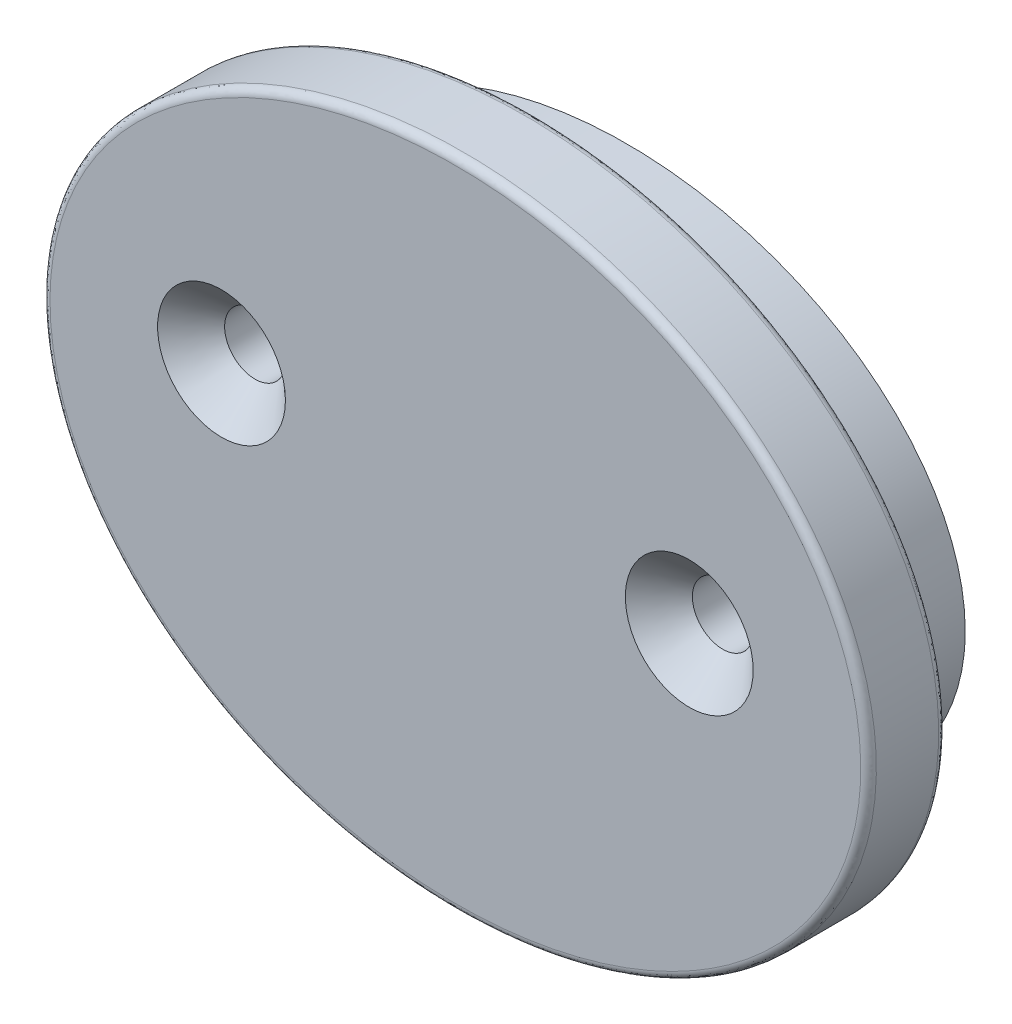
from build123d import *

# Parameters (mm, degrees)
SKIZZE1_RX                                           = 21.7
SKIZZE1_RY                                           = 16.2
AUFSATZ_LINEAR_AUSTRAGEN1_DEPTH                      = 6
SKIZZE2_RX                                           = 26.5
SKIZZE2_RY                                           = 21
AUFSATZ_LINEAR_AUSTRAGEN2_DEPTH                      = 5
FORMSENKUNG_F_R_M3_5_LINSENSENKSCHRAUBE1_D           = 3.9
FORMSENKUNG_F_R_M3_5_LINSENSENKSCHRAUBE1_CSINK_D     = 8.2
FORMSENKUNG_F_R_M3_5_LINSENSENKSCHRAUBE1_CSINK_ANGLE = 90
VERRUNDUNG1_R                                        = 0.5


with BuildPart() as part:
    # Skizze1 → Aufsatz-Linear austragen1 (new body)
    with BuildSketch(Plane.XY):
        with Locations((0, 0)):
            Ellipse(SKIZZE1_RX, SKIZZE1_RY)
    extrude(amount=AUFSATZ_LINEAR_AUSTRAGEN1_DEPTH)

    # Skizze2 → Aufsatz-Linear austragen2 (add)
    with BuildSketch(Plane.XY.offset(6)):
        with Locations((0, 0)):
            Ellipse(SKIZZE2_RX, SKIZZE2_RY)
    extrude(amount=AUFSATZ_LINEAR_AUSTRAGEN2_DEPTH)

    # Formsenkung für M3.5 Linsensenkschraube1 (through all)
    with Locations(Plane(origin=(-15, 2, 11), x_dir=(1, 0, 0), z_dir=(0, 0, 1))):
        with Locations((0, 0), (30, 0)):
            CounterSinkHole(FORMSENKUNG_F_R_M3_5_LINSENSENKSCHRAUBE1_D / 2, FORMSENKUNG_F_R_M3_5_LINSENSENKSCHRAUBE1_CSINK_D / 2, counter_sink_angle=FORMSENKUNG_F_R_M3_5_LINSENSENKSCHRAUBE1_CSINK_ANGLE)

    # Verrundung1
    verrundung1_edges = [part.edges().sort_by_distance(p)[0] for p in [
        (-26.499999579, -0.00374494, 6),
        (-26.499999579, -0.00374494, 11),
    ]]
    fillet(verrundung1_edges, radius=VERRUNDUNG1_R)


solid = part.part
